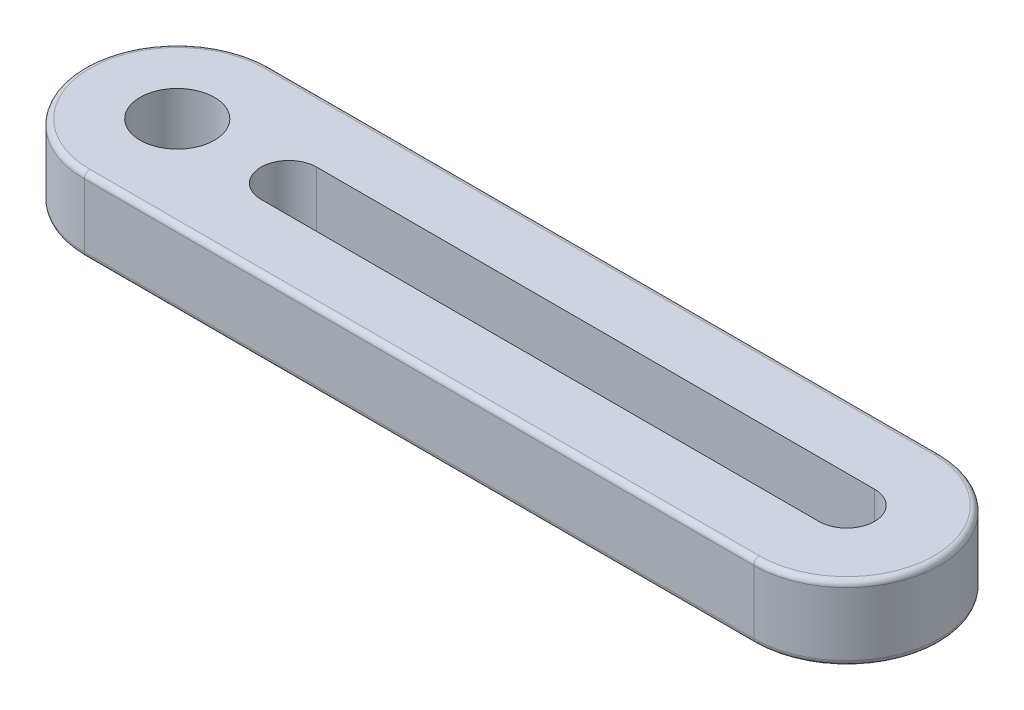
from build123d import *

# Parameters (mm, degrees)
SKETCH1_R           = 10
BOSS_EXTRUDE1_DEPTH = 10
FILLET1_R           = 1.5


with BuildPart() as part:
    # Sketch1 → Boss-Extrude1 (new, symmetric)
    with BuildSketch(Plane(origin=(0, 0, 0), x_dir=(1, 0, 0), z_dir=(0, 1, 0))):
        with BuildLine():
            Line((0, 25), (180, 25))
            ThreePointArc((180, 25), (205, 0), (180, -25))
            Line((180, -25), (0, -25))
            ThreePointArc((0, -25), (-25, 0), (0, 25))
        make_face()
        with Locations(Location((0, 0, 0), (0, 0, 270))):
            Circle(SKETCH1_R, mode=Mode.SUBTRACT)
        with BuildLine():
            Line((30, 7.5), (180, 7.5))
            ThreePointArc((180, 7.5), (187.5, 0), (180, -7.5))
            Line((180, -7.5), (30, -7.5))
            ThreePointArc((30, -7.5), (22.5, 0), (30, 7.5))
        make_face(mode=Mode.SUBTRACT)
    extrude(amount=BOSS_EXTRUDE1_DEPTH, both=True)

    # Fillet1
    fillet1_edges = [part.edges().sort_by_distance(p)[0] for p in [
        (205, 10, 0),
        (90, 10, -25),
        (-25, 10, 0),
        (90, -10, -25),
        (205, -10, 0),
        (90, -10, 25),
        (-25, -10, 0),
        (90, 10, 25),
    ]]
    fillet(fillet1_edges, radius=FILLET1_R)


solid = part.part
